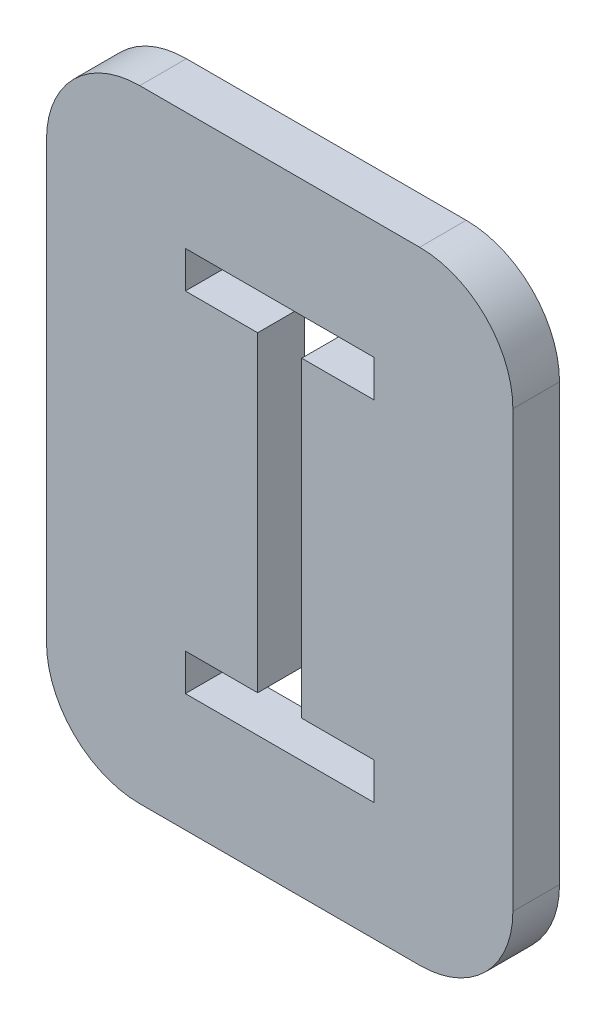
from build123d import *

# Parameters (mm, degrees)
BOSS_EXTRUDE1_DEPTH = 0.9525


with BuildPart() as part:
    # Sketch1 → Boss-Extrude1 (new, symmetric)
    with BuildSketch(Plane.XY):
        with BuildLine():
            Line((-5.715, 12.7), (5.715, 12.7))
            ThreePointArc((5.715, 12.7), (8.409076836, 11.584076836), (9.525, 8.89))
            Line((9.525, 8.89), (9.525, -8.89))
            ThreePointArc((9.525, -8.89), (8.409076836, -11.584076836), (5.715, -12.7))
            Line((5.715, -12.7), (-5.715, -12.7))
            ThreePointArc((-5.715, -12.7), (-8.409076836, -11.584076836), (-9.525, -8.89))
            Line((-9.525, -8.89), (-9.525, 8.89))
            ThreePointArc((-9.525, 8.89), (-8.409076836, 11.584076836), (-5.715, 12.7))
        make_face()
        Polygon((-3.85275, -6.367292239), (-3.85275, -7.874), (3.85275, -7.874), (3.85275, -6.367292239), (0.9, -6.367292239), (0.9, 6.367292239), (3.85275, 6.367292239), (3.85275, 7.874), (-3.85275, 7.874), (-3.85275, 6.367292239), (-0.9, 6.367292239), (-0.9, -6.367292239), align=None, mode=Mode.SUBTRACT)
    extrude(amount=BOSS_EXTRUDE1_DEPTH, both=True)


solid = part.part
